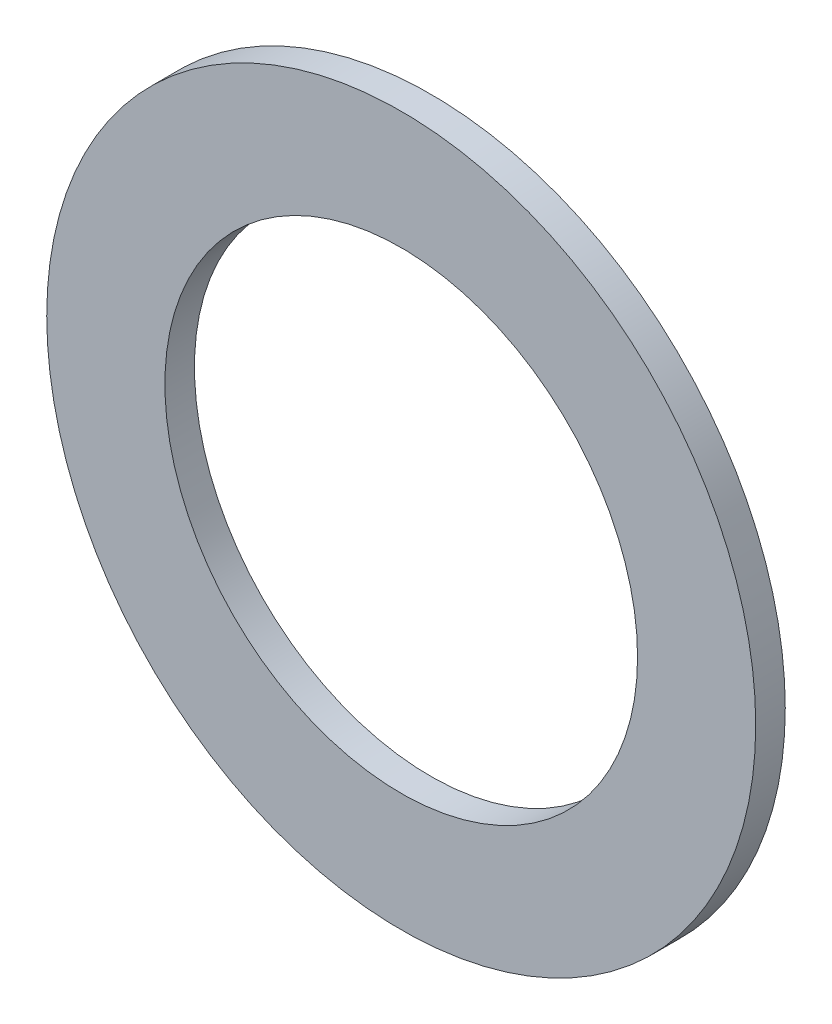
from build123d import *

# Parameters (mm, degrees)
SKETCH1_R           = 6
SKETCH1_R_2         = 4
BOSS_EXTRUDE1_DEPTH = 0.5


with BuildPart() as part:
    # Sketch1 → Boss-Extrude1 (new body)
    with BuildSketch(Plane.XY):
        Circle(SKETCH1_R)
        Circle(SKETCH1_R_2, mode=Mode.SUBTRACT)
    extrude(amount=BOSS_EXTRUDE1_DEPTH)


solid = part.part
